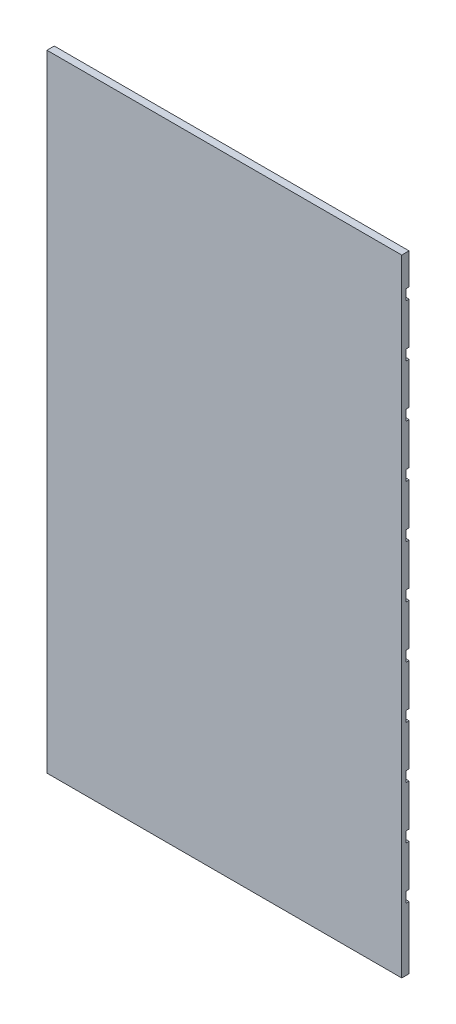
from build123d import *

# Parameters (mm, degrees)
SKETCH2_W           = 17.78
SKETCH2_H           = 1524
BOSS_EXTRUDE1_DEPTH = 863.6
SKETCH3_W           = 863.6
SKETCH3_H           = 25.4
CUT_EXTRUDE1_DEPTH  = 7.62


with BuildPart() as part:
    # Sketch2 → Boss-Extrude1 (new body)
    with BuildSketch(Plane(origin=(0, 0, 0), x_dir=(0, 0, -1), z_dir=(1, 0, 0))):
        with Locations((8.89, -762)):
            Rectangle(SKETCH2_W, SKETCH2_H)
    extrude(amount=BOSS_EXTRUDE1_DEPTH)

    # Sketch3 → Cut-Extrude1 (cut)
    with BuildSketch(Plane(origin=(0, 0, -17.78), x_dir=(-1, 0, 0), z_dir=(0, 0, -1))):
        with Locations((-431.8, -88.9)):
            Rectangle(SKETCH3_W, SKETCH3_H)
        with Locations((-431.8, -215.9)):
            Rectangle(SKETCH3_W, SKETCH3_H)
        with Locations((-431.8, -342.9)):
            Rectangle(SKETCH3_W, SKETCH3_H)
        with Locations((-431.8, -469.9)):
            Rectangle(SKETCH3_W, SKETCH3_H)
        with Locations((-431.8, -596.9)):
            Rectangle(SKETCH3_W, SKETCH3_H)
        with Locations((-431.8, -723.9)):
            Rectangle(SKETCH3_W, SKETCH3_H)
        with Locations((-431.8, -850.9)):
            Rectangle(SKETCH3_W, SKETCH3_H)
        with Locations((-431.8, -977.9)):
            Rectangle(SKETCH3_W, SKETCH3_H)
        with Locations((-431.8, -1104.9)):
            Rectangle(SKETCH3_W, SKETCH3_H)
        with Locations((-431.8, -1231.9)):
            Rectangle(SKETCH3_W, SKETCH3_H)
        with Locations((-431.8, -1358.9)):
            Rectangle(SKETCH3_W, SKETCH3_H)
    extrude(amount=-CUT_EXTRUDE1_DEPTH, mode=Mode.SUBTRACT)


solid = part.part
